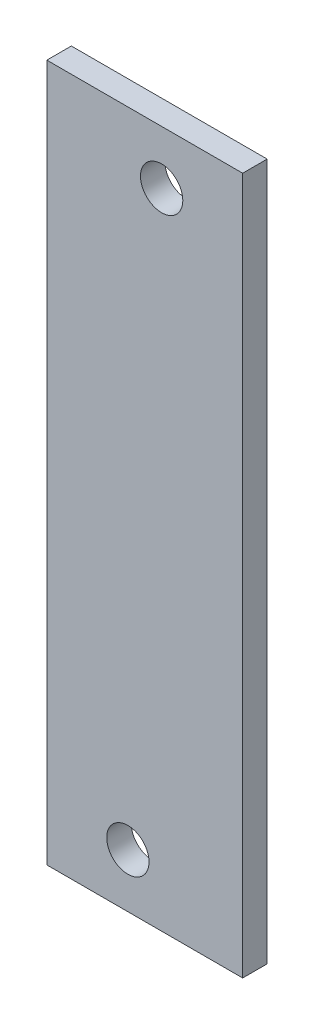
from build123d import *

# Parameters (mm, degrees)
SKETCH1_W           = 28
SKETCH1_H           = 99.66
SKETCH1_R           = 3.025
BOSS_EXTRUDE1_DEPTH = 3.5


with BuildPart() as part:
    # Sketch1 → Boss-Extrude1 (new body)
    with BuildSketch(Plane.XY):
        Rectangle(SKETCH1_W, SKETCH1_H)
        with Locations((-2.413, -42.164)):
            Circle(SKETCH1_R, mode=Mode.SUBTRACT)
        with Locations((2.413, 42.164)):
            Circle(SKETCH1_R, mode=Mode.SUBTRACT)
    extrude(amount=BOSS_EXTRUDE1_DEPTH)


solid = part.part
